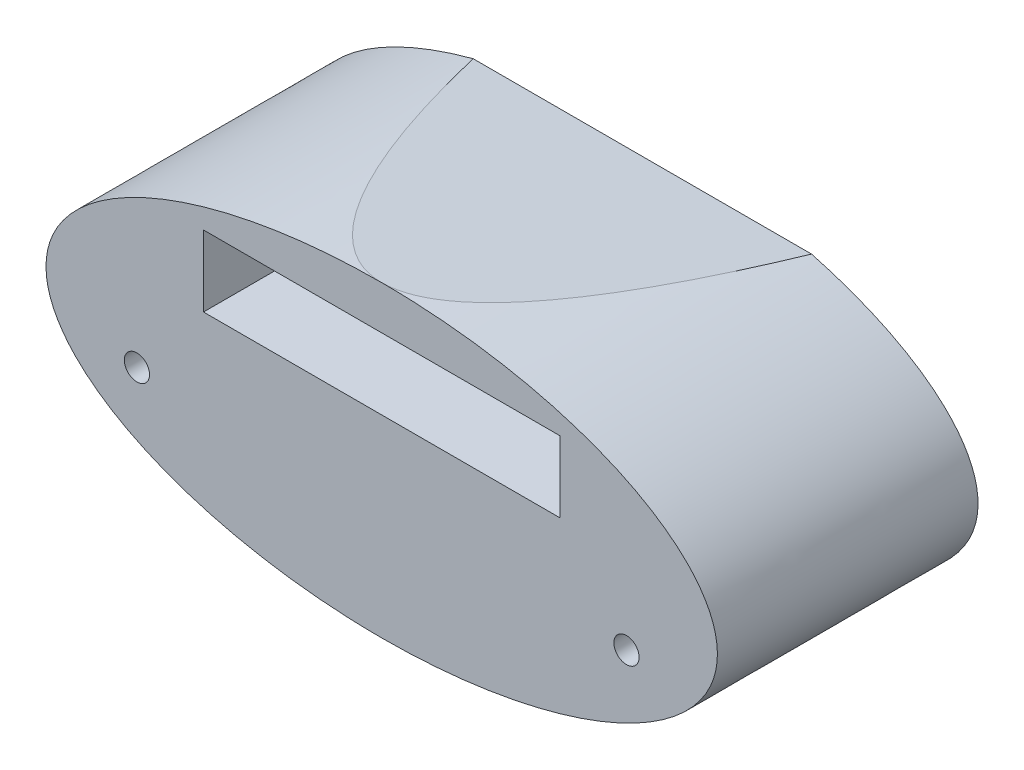
from build123d import *

# Parameters (mm, degrees)
SKETCH1_RX              = 240
SKETCH1_RY              = 110
BOSS_EXTRUDE1_DEPTH     = 186.33
SKETCH10_W              = 254.8
SKETCH10_H              = 50.8
CUT_EXTRUDE5_DEPTH      = 324.139085999
SKETCH12_R              = 9
CUT_EXTRUDE8_DEPTH      = 324.139085999
CUT_EXTRUDE9_DEPTH      = 324.139085999
CUT_EXTRUDE9_DEPTH_BACK = 324.139085999


with BuildPart() as part:
    # Sketch1 → Boss-Extrude1 (new body)
    with BuildSketch(Plane.XY):
        with Locations((0, 0)):
            Ellipse(SKETCH1_RX, SKETCH1_RY)
    extrude(amount=-BOSS_EXTRUDE1_DEPTH)

    # Sketch10 → Cut-Extrude5 (cut, through all)
    with BuildSketch(Plane.XY):
        with Locations((0, 53.5)):
            Rectangle(SKETCH10_W, SKETCH10_H)
    extrude(amount=-CUT_EXTRUDE5_DEPTH, mode=Mode.SUBTRACT)

    # Sketch12 → Cut-Extrude8 (cut, through all)
    with BuildSketch(Plane.XY):
        with Locations((175, -30)):
            Circle(SKETCH12_R)
        with Locations(Location((-175, -30, 0), (0, 0, 180))):
            Circle(SKETCH12_R)
    extrude(amount=-CUT_EXTRUDE8_DEPTH, mode=Mode.SUBTRACT)

    # Sketch14 → Cut-Extrude9 (cut, two sides: drawn at the far end of the back side and taken through both)
    with BuildSketch(Plane(origin=(0, 0, 0), x_dir=(0, 0, -1), z_dir=(1, 0, 0)).offset(-CUT_EXTRUDE9_DEPTH_BACK)):
        Polygon((0, 110), (186.33, 95), (186.33, 110), align=None)
        Polygon((0, -110), (186.33, -95), (186.33, -110), align=None)
    extrude(amount=CUT_EXTRUDE9_DEPTH + CUT_EXTRUDE9_DEPTH_BACK, mode=Mode.SUBTRACT)


solid = part.part
